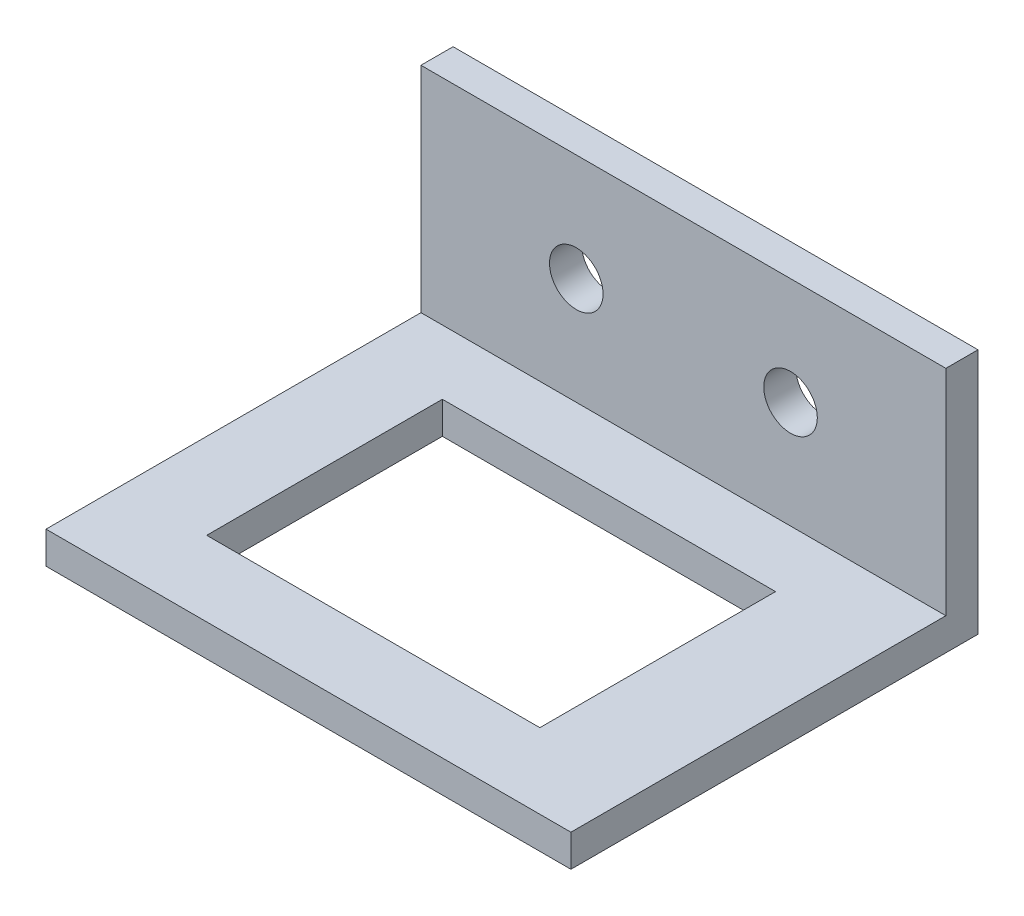
from build123d import *

# Parameters (mm, degrees)
BOSS_EXTRUDE1_DEPTH = 49
SKETCH7_W           = 31.1
SKETCH7_H           = 22
CUT_EXTRUDE5_DEPTH  = 3
SKETCH8_R           = 2.5
CUT_EXTRUDE6_DEPTH  = 3


with BuildPart() as part:
    # Sketch1 → Boss-Extrude1 (new body)
    with BuildSketch(Plane(origin=(0, 0, 0), x_dir=(0, 0, -1), z_dir=(1, 0, 0))):
        Polygon((-38, 0), (0, 0), (0, 23), (-3, 23), (-3, 3), (-38, 3), align=None)
    extrude(amount=BOSS_EXTRUDE1_DEPTH)

    # Sketch7 → Cut-Extrude5 (cut)
    with BuildSketch(Plane(origin=(0, 3, 0), x_dir=(1, 0, 0), z_dir=(0, 1, 0))):
        with Locations((23.55, -20)):
            Rectangle(SKETCH7_W, SKETCH7_H)
    extrude(amount=-CUT_EXTRUDE5_DEPTH, mode=Mode.SUBTRACT)

    # Sketch8 → Cut-Extrude6 (cut)
    with BuildSketch(Plane.XY.offset(3)):
        with Locations((14.5, 13)):
            Circle(SKETCH8_R)
        with Locations((34.5, 13)):
            Circle(SKETCH8_R)
    extrude(amount=-CUT_EXTRUDE6_DEPTH, mode=Mode.SUBTRACT)


solid = part.part
